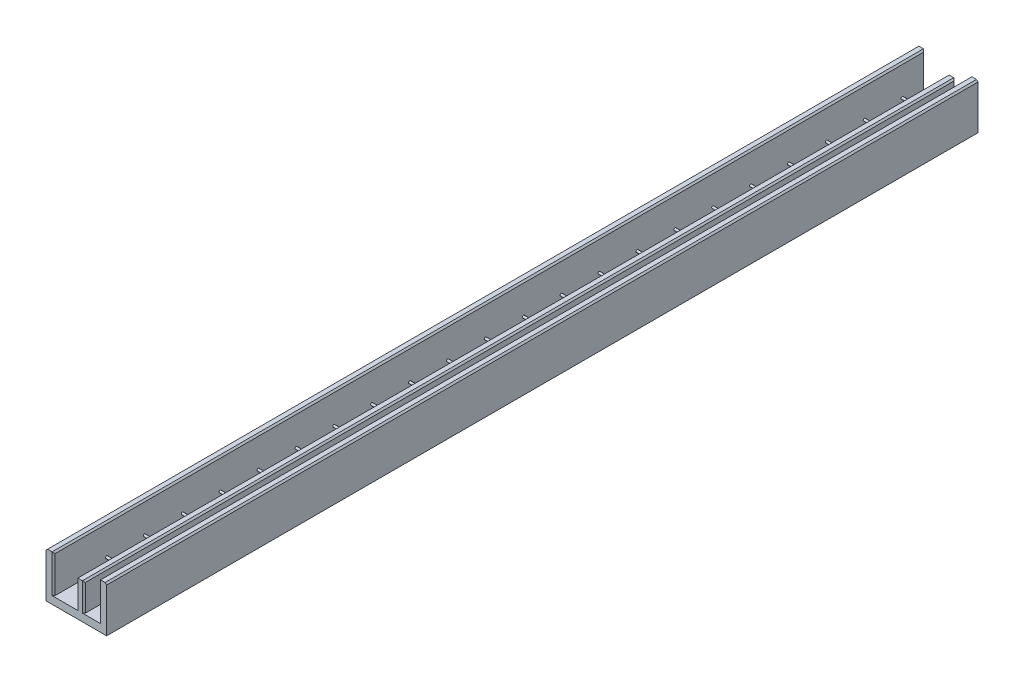
from build123d import *

# Parameters (mm, degrees)
SALIENTE_EXTRUIR1_DEPTH = 11500
CHAFL_N2_SIZE           = 20
SALIENTE_EXTRUIR2_REACH = 11545.396
CROQUIS2_R              = 15
MATRIZL1_COUNT          = 22
MATRIZL1_PITCH          = 500


with BuildPart() as part:
    # Croquis1 → Saliente-Extruir1 (new body)
    with BuildSketch(Plane.XY):
        Polygon((0, 0), (-800, 0), (-800, 600), (-700, 600), (-700, 100), (-400, 100), (-400, 470), (-300, 470), (-300, 100), (-100, 100), (-100, 600), (0, 600), align=None)
    extrude(amount=SALIENTE_EXTRUIR1_DEPTH)

    # Chaflán2
    chafl_n2_edges = [part.edges().sort_by_distance(p)[0] for p in [
        (-100, 350, 11500),
        (-700, 350, 0),
        (-400, 285, 0),
        (-300, 285, 0),
        (-100, 350, 0),
        (-300, 285, 11500),
        (-800, 600, 5750),
        (-700, 600, 5750),
        (-400, 470, 5750),
        (-300, 470, 5750),
        (-100, 600, 5750),
        (0, 600, 5750),
        (-400, 285, 11500),
        (-700, 350, 11500),
    ]]
    chamfer(chafl_n2_edges, length=CHAFL_N2_SIZE)

    # Saliente-Extruir2: up to this face of the body (flat: up to its plane)
    saliente_extruir2_end = Plane(part.part.faces().sort_by_distance((-100, 340, 5750))[0])
    # Croquis2 → Saliente-Extruir2 (add, up to the picked face)
    with BuildSketch(Plane.ZY.offset(800), mode=Mode.PRIVATE) as saliente_extruir2_sk1:
        with Locations(Location((300, 200, 0), (0, 0, 270))):
            Circle(CROQUIS2_R)
    saliente_extruir2_tool1 = split(extrude(saliente_extruir2_sk1.sketch, amount=-SALIENTE_EXTRUIR2_REACH, mode=Mode.PRIVATE), bisect_by=saliente_extruir2_end, keep=Keep.BOTH, mode=Mode.PRIVATE)
    saliente_extruir2 = saliente_extruir2_tool1.solids().sort_by(Axis((-800, 200, 300), (1, 0, 0)))[0]
    add(saliente_extruir2)

    # MatrizL1: Saliente-Extruir2 ×22
    with Locations(*[(0, 0, i * MATRIZL1_PITCH) for i in range(1, MATRIZL1_COUNT)]):
        add(saliente_extruir2)


solid = part.part
